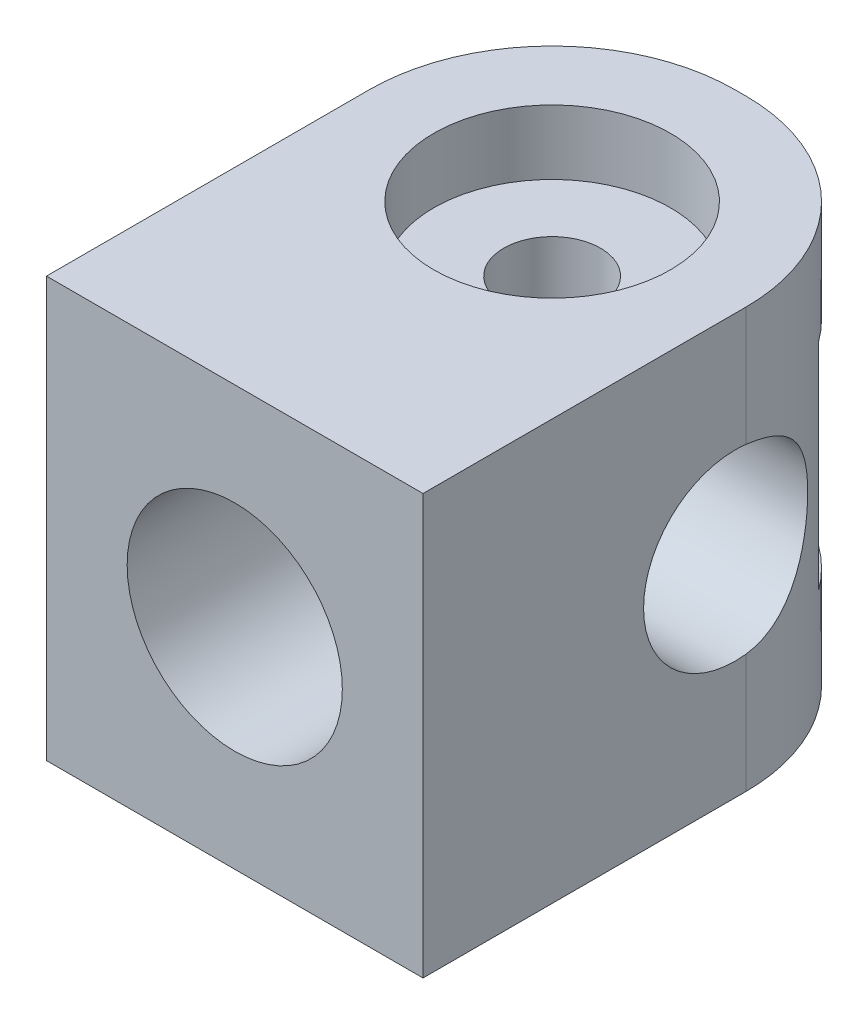
from build123d import *
from build123d.topology import SkipClean

# Parameters (mm, degrees)
ESQUISSE1_W             = 35
ESQUISSE1_H             = 39
BOSS_EXTRU_1_DEPTH      = 47
ENL_V_MAT_EXTRU_1_DEPTH = 20
CONG_1_R                = 17
ESQUISSE3_W             = 1
ESQUISSE3_H             = 20
ESQUISSE3_W_2           = 17
ENL_V_MAT_EXTRU_2_DEPTH = 7
ENL_V_MAT_EXTRU_3_DEPTH = 29
ESQUISSE5_R             = 4.5
ENL_V_MAT_EXTRU_4_DEPTH = 71.391760987
ESQUISSE7_R             = 11
ENL_V_MAT_EXTRU_5_DEPTH = 6
ENL_V_START             = -6
ESQUISSE8_R             = 11
ENL_V_MAT_EXTRU_6_DEPTH = 6
ENL_V_MAT_EXTRU_7_DEPTH = 6


with BuildPart() as part:
    # Esquisse1 → Boss.-Extru.1 (new body)
    with BuildSketch(Plane.XY):
        with Locations((17.5, -19.5)):
            Rectangle(ESQUISSE1_W, ESQUISSE1_H)
    extrude(amount=BOSS_EXTRU_1_DEPTH)

    # Esquisse2 → Enlèv. mat.-Extru.1 (cut)
    with BuildSketch(Plane.XY.offset(47)):
        with BuildLine():
            ThreePointArc((27.5, -19.5), (21.574863545, -10.367887041), (10.820902582, -12.057577163))
            Line((10.820902582, -12.057577163), (24.179097418, -26.942422837))
            ThreePointArc((24.179097418, -26.942422837), (26.632112959, -23.574863545), (27.5, -19.5))
        make_face()
        with BuildLine():
            Line((24.179097418, -26.942422837), (10.820902582, -12.057577163))
            ThreePointArc((10.820902582, -12.057577163), (10.057577163, -26.179097418), (24.179097418, -26.942422837))
        make_face()
    extrude(amount=-ENL_V_MAT_EXTRU_1_DEPTH, mode=Mode.SUBTRACT)

    # Congé1
    cong_1_edges = [part.edges().sort_by_distance(p)[0] for p in [
        (35, -19.5, 0),
        (0, -19.5, 0),
    ]]
    fillet(cong_1_edges, radius=CONG_1_R)

    # Esquisse3 → Enlèv. mat.-Extru.2 (cut)
    with BuildSketch(Plane(origin=(0, 0, 0), x_dir=(-1, 0, 0), z_dir=(0, 0, -1))):
        with Locations((-17.5, -19.5)):
            Rectangle(ESQUISSE3_W, ESQUISSE3_H)
        with Locations((-26.5, -19.5)):
            Rectangle(ESQUISSE3_W_2, ESQUISSE3_H)
        with Locations((-8.5, -19.5)):
            Rectangle(ESQUISSE3_W_2, ESQUISSE3_H)
    extrude(amount=-ENL_V_MAT_EXTRU_2_DEPTH, mode=Mode.SUBTRACT)

    # Esquisse4 → Enlèv. mat.-Extru.3 (cut)
    with BuildSketch(Plane(origin=(35, 0, 0), x_dir=(0, 0, -1), z_dir=(1, 0, 0))):
        with BuildLine():
            ThreePointArc((-18, -11), (-26.5, -19.5), (-18, -28))
            Line((-18, -28), (-18, -11))
        make_face()
        with BuildLine():
            Line((-17, -11.059028492), (-17, -27.940971508))
            ThreePointArc((-17, -27.940971508), (-11.645867486, -25.145794895), (-9.5, -19.5))
            ThreePointArc((-9.5, -19.5), (-11.645867486, -13.854205105), (-17, -11.059028492))
        make_face()
        with BuildLine():
            Line((-18, -11), (-18, -28))
            ThreePointArc((-18, -28), (-17.499129667, -27.985230045), (-17, -27.940971508))
            Line((-17, -27.940971508), (-17, -11.059028492))
            ThreePointArc((-17, -11.059028492), (-17.499129667, -11.014769955), (-18, -11))
        make_face()
    extrude(amount=-ENL_V_MAT_EXTRU_3_DEPTH, mode=Mode.SUBTRACT)

    # Esquisse5 → Enlèv. mat.-Extru.4 (cut, through all)
    with SkipClean():  # the faces are left unmerged after this step: merging them gives an invalid solid
        with BuildSketch(Plane(origin=(0, 0, 0), x_dir=(1, 0, 0), z_dir=(0, 1, 0))):
            with Locations(Location((17.5, -17.5, 0), (0, 0, 270))):
                Circle(ESQUISSE5_R)
        extrude(amount=-ENL_V_MAT_EXTRU_4_DEPTH, mode=Mode.SUBTRACT)

    # Esquisse7 → Enlèv. mat.-Extru.5 (cut)
    with SkipClean():  # the faces are left unmerged after this step: merging them gives an invalid solid
        with BuildSketch(Plane(origin=(0, 0, 0), x_dir=(1, 0, 0), z_dir=(0, 1, 0))):
            with Locations(Location((17.5, -17.5, 0), (0, 0, 270))):
                Circle(ESQUISSE7_R)
        extrude(amount=-ENL_V_MAT_EXTRU_5_DEPTH, mode=Mode.SUBTRACT)

    # Esquisse8 → Enlèv. mat.-Extru.6 (cut)
    with SkipClean():  # the faces are left unmerged after this step: merging them gives an invalid solid
        with BuildSketch(Plane.XZ.offset(39).offset(ENL_V_START)):
            with Locations(Location((17.5, 17.5, 0), (0, 0, 90))):
                Circle(ESQUISSE8_R)
        extrude(amount=ENL_V_MAT_EXTRU_6_DEPTH, mode=Mode.SUBTRACT)

    # Esquisse10 → Enlèv. mat.-Extru.7 (cut)
    with SkipClean():  # the faces are left unmerged after this step: merging them gives an invalid solid
        with BuildSketch(Plane.ZY):
            with BuildLine():
                ThreePointArc((17, -23.887482194), (20.80624304, -23.01781182), (22.5, -19.5))
                ThreePointArc((22.5, -19.5), (20.80624304, -15.98218818), (17, -15.112517806))
                Line((17, -15.112517806), (17, -23.887482194))
            make_face()
            with BuildLine():
                Line((17, -23.887482194), (17, -15.112517806))
                ThreePointArc((17, -15.112517806), (13.5, -19.5), (17, -23.887482194))
            make_face()
        extrude(amount=-ENL_V_MAT_EXTRU_7_DEPTH, mode=Mode.SUBTRACT)


solid = part.part
